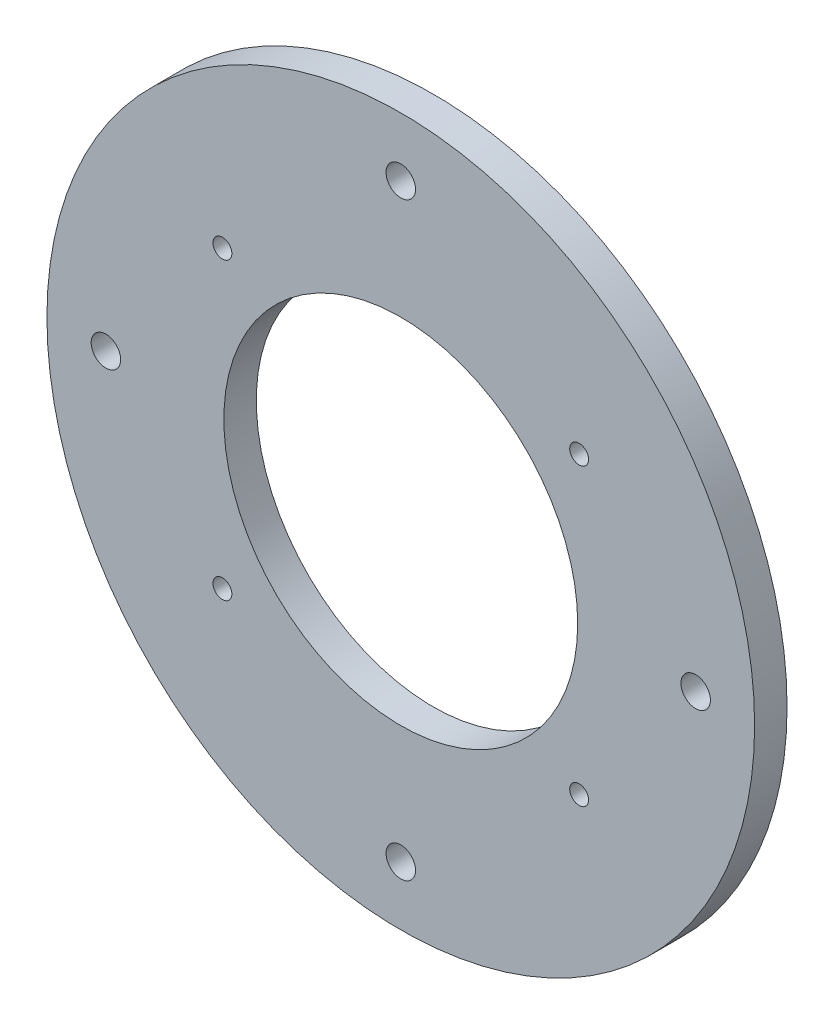
from build123d import *

# Parameters (mm, degrees)
SKETCH_1_R               = 60
SKETCH_1_R_2             = 30
EXTRUDE_1_DEPTH          = 5.5
CUT_EXTRUDE_1_DEPTH      = 86.030876745
CUT_EXTRUDE_1_DEPTH_BACK = 86.030876745
SKETCH_2_R               = 2.5
CUT_EXTRUDE_3_DEPTH      = 86.030876745
CUT_EXTRUDE_3_DEPTH_BACK = 86.030876745
SKETCH_3_R               = 1.6


with BuildPart() as part:
    # ｽｹｯﾁ1 → ﾎﾞｽ - 押し出し1 (new body)
    with BuildSketch(Plane.XY):
        Circle(SKETCH_1_R)
        Circle(SKETCH_1_R_2, mode=Mode.SUBTRACT)
    extrude(amount=EXTRUDE_1_DEPTH)

    # ｽｹｯﾁ2 → ｶｯﾄ - 押し出し1 (cut, two sides: drawn at the far end of the back side and taken through both)
    with BuildSketch(Plane.XY.offset(5.5).offset(-CUT_EXTRUDE_1_DEPTH_BACK)):
        with Locations((0, -50)):
            Circle(SKETCH_2_R)
        with Locations((-50, 0)):
            Circle(SKETCH_2_R)
        with Locations((50, 0)):
            Circle(SKETCH_2_R)
        with Locations((0, 50)):
            Circle(SKETCH_2_R)
    extrude(amount=CUT_EXTRUDE_1_DEPTH + CUT_EXTRUDE_1_DEPTH_BACK, mode=Mode.SUBTRACT)

    # ｽｹｯﾁ3 → ｶｯﾄ - 押し出し3 (cut, two sides: drawn at the far end of the back side and taken through both)
    with BuildSketch(Plane.XY.offset(5.5).offset(-CUT_EXTRUDE_3_DEPTH_BACK)):
        with Locations((30.245839942, 25)):
            Circle(SKETCH_3_R)
        with Locations((-30.245839942, 25)):
            Circle(SKETCH_3_R)
        with Locations((-30.245839942, -25)):
            Circle(SKETCH_3_R)
        with Locations((30.245839942, -25)):
            Circle(SKETCH_3_R)
    extrude(amount=CUT_EXTRUDE_3_DEPTH + CUT_EXTRUDE_3_DEPTH_BACK, mode=Mode.SUBTRACT)


solid = part.part
